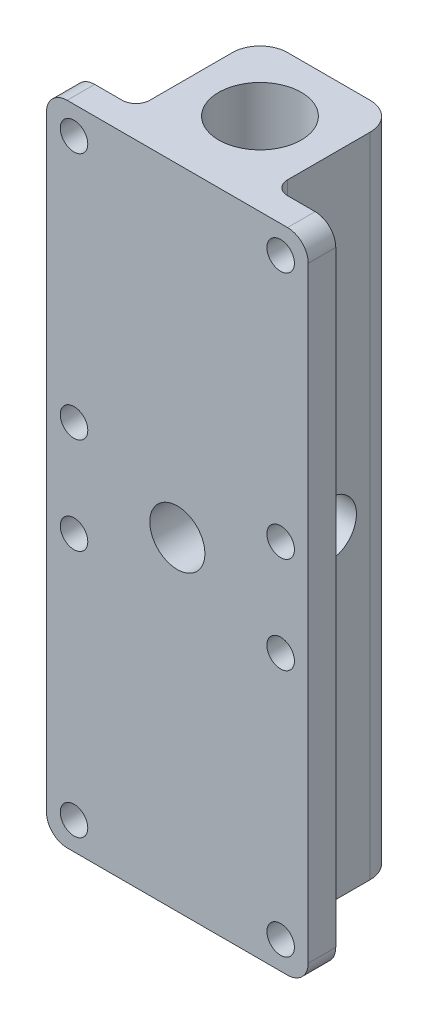
from build123d import *

# Parameters (mm, degrees)
BOSS_EXTRUDE2_DEPTH = 101.6
SKETCH2_R           = 50.8
CUT_EXTRUDE1_DEPTH  = 1292.659304925
SKETCH3_R           = 152.4
BOSS_EXTRUDE3_DEPTH = 2387.6
FILLET1_R           = 50.8
SKETCH4_R           = 101.6
CUT_EXTRUDE2_DEPTH  = 1404.680390972
SKETCH5_R           = 101.6
CUT_EXTRUDE3_DEPTH  = 1476.388030428


with BuildPart() as part:
    # Sketch1 → Boss-Extrude2 (new body)
    with BuildSketch(Plane.XY):
        with BuildLine():
            Line((-406.4, 1193.8), (406.4, 1193.8))
            ThreePointArc((406.4, 1193.8), (460.281536726, 1171.481536726), (482.6, 1117.6))
            Line((482.6, 1117.6), (482.6, -1117.6))
            ThreePointArc((482.6, -1117.6), (460.281536726, -1171.481536726), (406.4, -1193.8))
            Line((406.4, -1193.8), (-406.4, -1193.8))
            ThreePointArc((-406.4, -1193.8), (-460.281536726, -1171.481536726), (-482.6, -1117.6))
            Line((-482.6, -1117.6), (-482.6, 1117.6))
            ThreePointArc((-482.6, 1117.6), (-460.281536726, 1171.481536726), (-406.4, 1193.8))
        make_face()
    extrude(amount=BOSS_EXTRUDE2_DEPTH)

    # Sketch2 → Cut-Extrude1 (cut, through all)
    with BuildSketch(Plane.XY.offset(101.6)):
        with Locations((-381, 1092.2)):
            Circle(SKETCH2_R)
        with Locations((-381, 177.8)):
            Circle(SKETCH2_R)
        with Locations((-381, -177.8)):
            Circle(SKETCH2_R)
        with Locations((-381, -1092.2)):
            Circle(SKETCH2_R)
        with Locations((381, 1092.2)):
            Circle(SKETCH2_R)
        with Locations((381, 177.8)):
            Circle(SKETCH2_R)
        with Locations((381, -177.8)):
            Circle(SKETCH2_R)
        with Locations((381, -1092.2)):
            Circle(SKETCH2_R)
    extrude(amount=-CUT_EXTRUDE1_DEPTH, mode=Mode.SUBTRACT)

    # Sketch3 → Boss-Extrude3 (add)
    with BuildSketch(Plane(origin=(0, 1193.8, 0), x_dir=(1, 0, 0), z_dir=(0, 1, 0))):
        with BuildLine():
            Line((-254, 0), (254, 0))
            Line((254, 0), (254, 355.6))
            ThreePointArc((254, 355.6), (224.242048969, 427.442048969), (152.4, 457.2))
            Line((152.4, 457.2), (-152.4, 457.2))
            ThreePointArc((-152.4, 457.2), (-224.242048969, 427.442048969), (-254, 355.6))
            Line((-254, 355.6), (-254, 0))
        make_face()
        with Locations(Location((0, 203.2, 0), (0, 0, 270))):
            Circle(SKETCH3_R, mode=Mode.SUBTRACT)
    extrude(amount=-BOSS_EXTRUDE3_DEPTH)

    # Fillet1
    fillet1_edges = [part.edges().sort_by_distance(p)[0] for p in [
        (-254, 0, 0),
        (254, 0, 0),
    ]]
    fillet(fillet1_edges, radius=FILLET1_R)

    # Sketch4 → Cut-Extrude2 (cut, through all)
    with BuildSketch(Plane(origin=(0, 0, -457.2), x_dir=(-1, 0, 0), z_dir=(0, 0, -1))):
        Circle(SKETCH4_R)
    extrude(amount=-CUT_EXTRUDE2_DEPTH, mode=Mode.SUBTRACT)

    # Sketch5 → Cut-Extrude3 (cut, through all)
    with BuildSketch(Plane.ZY.offset(254)):
        with Locations((-203.2, 0)):
            Circle(SKETCH5_R)
    extrude(amount=-CUT_EXTRUDE3_DEPTH, mode=Mode.SUBTRACT)


solid = part.part
